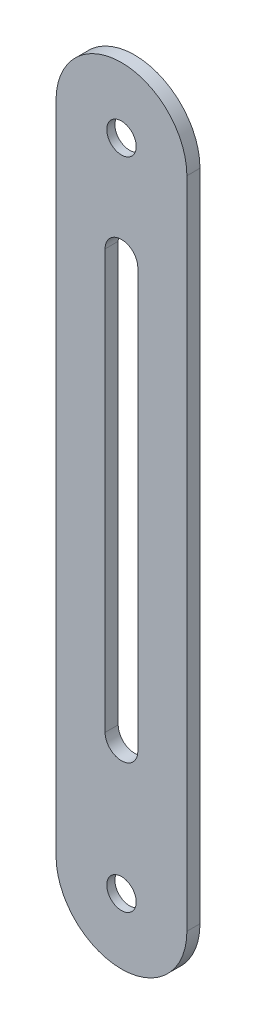
from build123d import *

# Parameters (mm, degrees)
SKETCH_1_R          = 8.75
EXTRUDE_1_DEPTH     = 4
EXTRUDE_START       = -2.5
SKETCH_3_R          = 8.75
SKETCH_3_R_2        = 4.5
EXTRUDE_2_DEPTH     = 2.5
CUT_EXTRUDE_2_DEPTH = 221.943431674


with BuildPart() as part:
    # 草图1 → 凸台-拉伸1 (new body)
    with BuildSketch(Plane.XY):
        with BuildLine():
            Line((-20, 0), (-20, -200))
            ThreePointArc((-20, -200), (0, -220), (20, -200))
            Line((20, -200), (20, 0))
            ThreePointArc((20, 0), (0, 20), (-20, 0))
        make_face()
        Circle(SKETCH_1_R, mode=Mode.SUBTRACT)
        with Locations((0, -200)):
            Circle(SKETCH_1_R, mode=Mode.SUBTRACT)
    extrude(amount=EXTRUDE_1_DEPTH)

    # 草图3 → 凸台-拉伸2 (add)
    # profile 1 of 2: a face of its own
    with BuildSketch(Plane.XY.offset(4).offset(EXTRUDE_START)):
        Circle(SKETCH_3_R)
        Circle(SKETCH_3_R_2, mode=Mode.SUBTRACT)
    # profile 2 of 2: a face of its own
    with BuildSketch(Plane.XY.offset(4).offset(EXTRUDE_START)):
        with Locations((0, -200)):
            Circle(SKETCH_3_R)
        with Locations((0, -200)):
            Circle(SKETCH_3_R_2, mode=Mode.SUBTRACT)
    extrude(amount=EXTRUDE_2_DEPTH)

    # 草图2 → 切除-拉伸2 (cut, through all)
    with BuildSketch(Plane.XY.offset(4)):
        with BuildLine():
            Line((-5, -31.845004689), (-5, -159.845004689))
            ThreePointArc((-5, -159.845004689), (0, -164.845004689), (5, -159.845004689))
            Line((5, -159.845004689), (5, -31.845004689))
            ThreePointArc((5, -31.845004689), (0, -26.845004689), (-5, -31.845004689))
        make_face()
    extrude(amount=-CUT_EXTRUDE_2_DEPTH, mode=Mode.SUBTRACT)


solid = part.part
